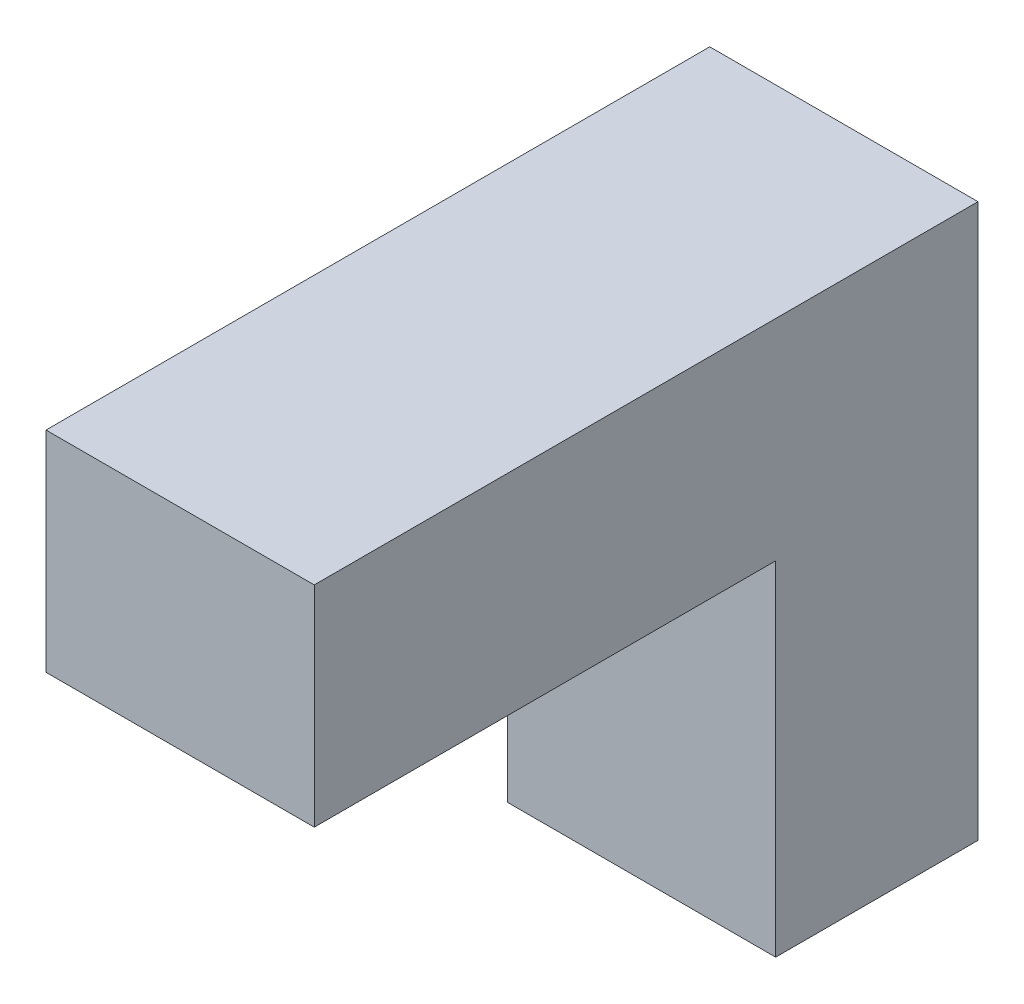
from build123d import *

# Parameters (mm, degrees)
EXTRUDE_1_DEPTH     = 9.7
SKETCH_2_W          = 7.7
SKETCH_2_H          = 5.316419403
CUT_EXTRUDE_1_DEPTH = 17


with BuildPart() as part:
    # 草圖1 → 填料-伸長1 (new body)
    with BuildSketch(Plane(origin=(0, 0, 0), x_dir=(0, 0, -1), z_dir=(1, 0, 0))):
        Polygon((0, 0), (0, 20), (-24, 20), (-24, 12.4126021), (-7.316419403, 12.4126021), (-7.316419403, 0), align=None)
    extrude(amount=EXTRUDE_1_DEPTH)

    # 草圖2 → 除料-伸長1 (cut)
    with BuildSketch(Plane.XZ):
        with Locations((4.85, 3.658209702)):
            Rectangle(SKETCH_2_W, SKETCH_2_H)
    extrude(amount=-CUT_EXTRUDE_1_DEPTH, mode=Mode.SUBTRACT)


solid = part.part
